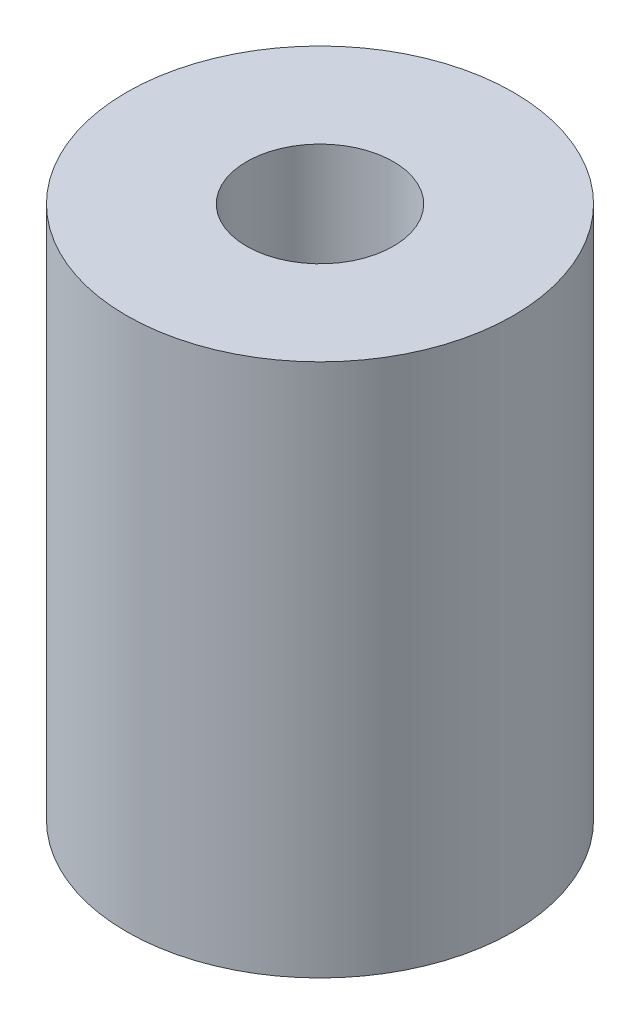
from build123d import *

# Parameters (mm, degrees)
SKETCH1_R           = 2.9
SKETCH1_R_2         = 1.1
BOSS_EXTRUDE1_DEPTH = 8


with BuildPart() as part:
    # Sketch1 → Boss-Extrude1 (new body)
    with BuildSketch(Plane(origin=(0, 0, 0), x_dir=(1, 0, 0), z_dir=(0, 1, 0))):
        with Locations(Location((0, 0, 0), (0, 0, 270))):
            Circle(SKETCH1_R)
        with Locations(Location((0, 0, 0), (0, 0, 270))):
            Circle(SKETCH1_R_2, mode=Mode.SUBTRACT)
    extrude(amount=BOSS_EXTRUDE1_DEPTH)


solid = part.part
